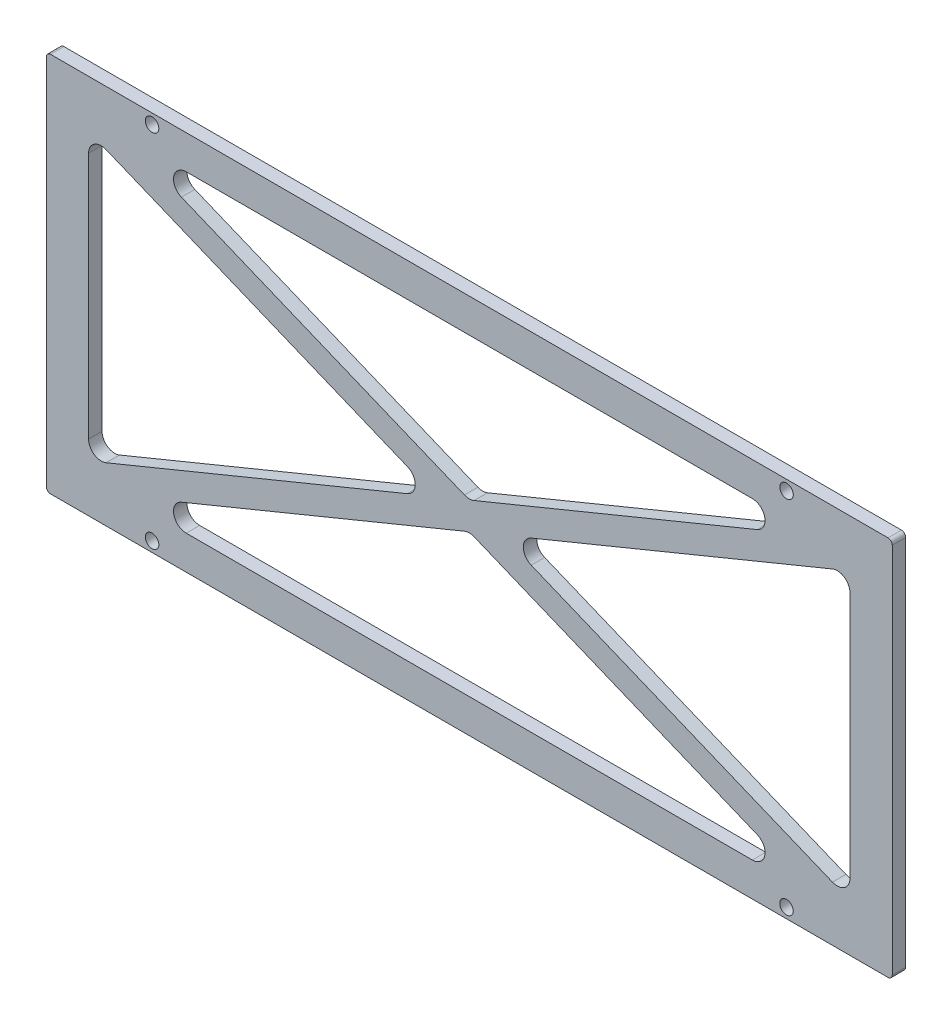
from build123d import *

# Parameters (mm, degrees)
SKETCH1_W            = 200
SKETCH1_H            = 90
BOSS_EXTRUDE1_DEPTH  = 3.175
CUT_EXTRUDE1_DEPTH   = 110.704515062
M3_CLEARANCE_HOLE1_D = 3.2
FILLET1_R            = 3
FILLET2_R            = 1


with BuildPart() as part:
    # Sketch1 → Boss-Extrude1 (new body)
    with BuildSketch(Plane.XY):
        Rectangle(SKETCH1_W, SKETCH1_H)
    extrude(amount=BOSS_EXTRUDE1_DEPTH)

    # Sketch2 → Cut-Extrude1 (cut, through all)
    with BuildSketch(Plane.XY.offset(3.175)):
        Polygon((-82.110098363, 37), (82.110098363, 37), (0, 3.243626229), align=None)
        Polygon((-90, 33.756373771), (-90, -33.756373771), (-7.889901637, 0), align=None)
        Polygon((90, 33.756373771), (7.889901637, 0), (90, -33.756373771), align=None)
        Polygon((-82.110098363, -37), (0, -3.243626229), (82.110098363, -37), align=None)
    extrude(amount=-CUT_EXTRUDE1_DEPTH, mode=Mode.SUBTRACT)

    # M3 Clearance Hole1 (through all)
    with Locations(Plane.XY.offset(3.175)):
        with Locations((-75, 42.61875), (75, 42.61875), (75, -42.61875), (-75, -42.61875)):
            Hole(M3_CLEARANCE_HOLE1_D / 2)

    # Fillet1
    fillet1_edges = [part.edges().sort_by_distance(p)[0] for p in [
        (-90, 33.756373771, 1.5875),
        (-7.889901637, 0, 1.5875),
        (-90, -33.756373771, 1.5875),
        (90, 33.756373771, 1.5875),
        (90, -33.756373771, 1.5875),
        (7.889901637, 0, 1.5875),
        (82.110098363, -37, 1.5875),
        (-82.110098363, -37, 1.5875),
        (0, -3.243626229, 1.5875),
        (0, 3.243626229, 1.5875),
        (-82.110098363, 37, 1.5875),
        (82.110098363, 37, 1.5875),
    ]]
    fillet(fillet1_edges, radius=FILLET1_R)

    # Fillet2
    fillet2_edges = [part.edges().sort_by_distance(p)[0] for p in [
        (100, -45, 1.5875),
        (-100, -45, 1.5875),
        (-100, 45, 1.5875),
        (100, 45, 1.5875),
    ]]
    fillet(fillet2_edges, radius=FILLET2_R)


solid = part.part
